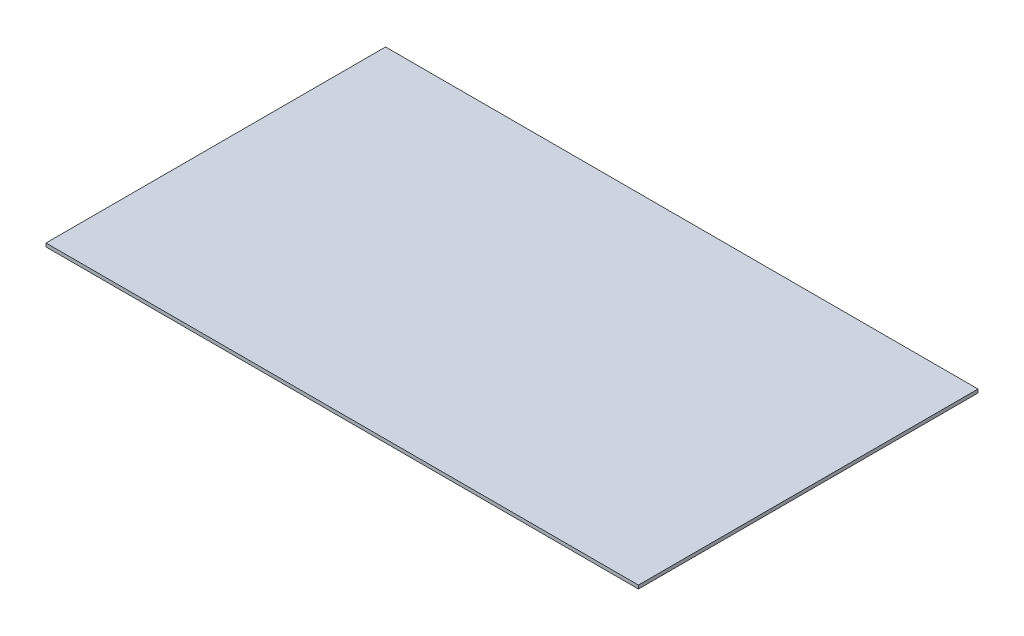
from build123d import *

# Parameters (mm, degrees)
SKETCH1_W           = 1085.85
SKETCH1_H           = 622.3
BOSS_EXTRUDE1_DEPTH = 6.35


with BuildPart() as part:
    # Sketch1 → Boss-Extrude1 (new body)
    with BuildSketch(Plane(origin=(0, 0, 0), x_dir=(1, 0, 0), z_dir=(0, 1, 0))):
        with Locations((484.264701948, -927.854291563)):
            Rectangle(SKETCH1_W, SKETCH1_H)
    extrude(amount=BOSS_EXTRUDE1_DEPTH)


solid = part.part
